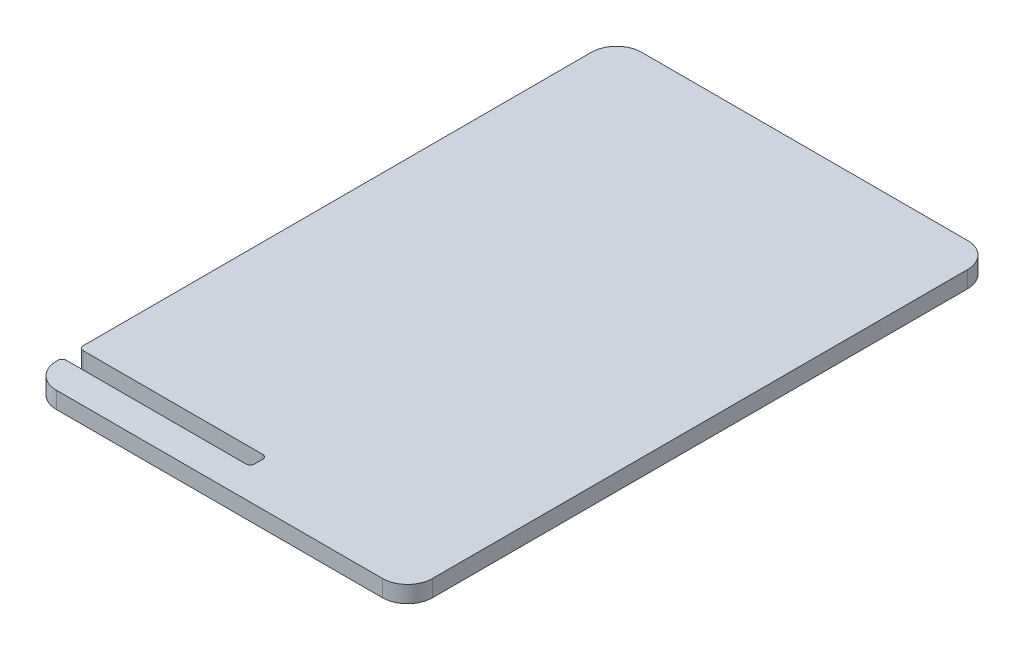
from build123d import *

# Parameters (mm, degrees)
CROQUIS1_W              = 45
CROQUIS1_H              = 70
SALIENTE_EXTRUIR1_DEPTH = 2
CROQUIS2_W              = 22.5
CROQUIS2_H              = 2
CORTAR_EXTRUIR1_DEPTH   = 2
REDONDEO1_R             = 3
REDONDEO2_R             = 0.5


with BuildPart() as part:
    # Croquis1 → Saliente-Extruir1 (new body)
    with BuildSketch(Plane(origin=(0, 0, 0), x_dir=(1, 0, 0), z_dir=(0, 1, 0))):
        with Locations((0, 0.306231574)):
            Rectangle(CROQUIS1_W, CROQUIS1_H)
    extrude(amount=SALIENTE_EXTRUIR1_DEPTH)

    # Croquis2 → Cortar-Extruir1 (cut)
    with BuildSketch(Plane(origin=(0, 2, 0), x_dir=(1, 0, 0), z_dir=(0, 1, 0))):
        with Locations((-11.25, -30)):
            Rectangle(CROQUIS2_W, CROQUIS2_H)
    extrude(amount=-CORTAR_EXTRUIR1_DEPTH, mode=Mode.SUBTRACT)

    # Redondeo1
    redondeo1_edges = [part.edges().sort_by_distance(p)[0] for p in [
        (-22.5, 1, -35.306231574),
        (22.5, 1, -35.306231574),
        (22.5, 1, 34.693768426),
        (-22.5, 1, 34.693768426),
    ]]
    fillet(redondeo1_edges, radius=REDONDEO1_R)

    # Redondeo2
    redondeo2_edges = [part.edges().sort_by_distance(p)[0] for p in [
        (-22.5, 1, 31),
        (-22.5, 1, 29),
        (0, 1, 29),
        (0, 1, 31),
    ]]
    fillet(redondeo2_edges, radius=REDONDEO2_R)


solid = part.part
